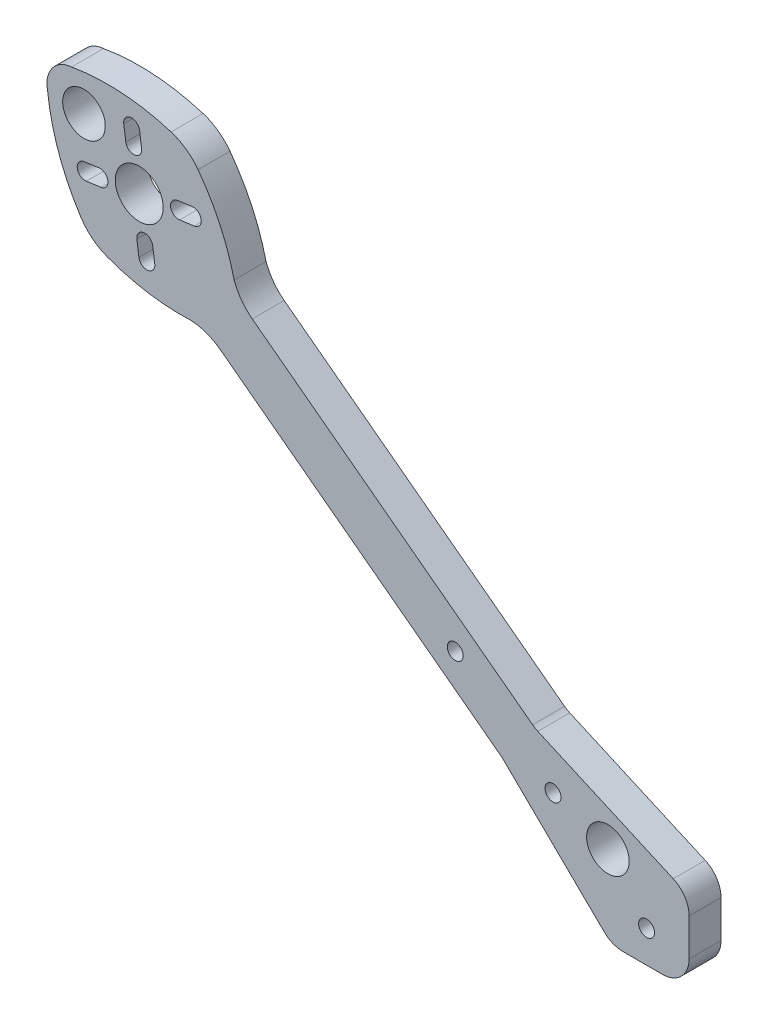
from build123d import *

# Parameters (mm, degrees)
CROQUIS1_R              = 1.5
CROQUIS1_R_2            = 4
CROQUIS1_R_3            = 4.5
SALIENTE_EXTRUIR1_DEPTH = 6


with BuildPart() as part:
    # Croquis1 → Saliente-Extruir1 (new body)
    with BuildSketch(Plane.XY):
        with BuildLine():
            ThreePointArc((-166.230647244, 74.874670253), (-162.695113338, 76.339136347), (-161.230647244, 79.874670253))
            Line((-161.230647244, 79.874670253), (-161.230647244, 86.870701075))
            ThreePointArc((-161.230647244, 86.870701075), (-162.039949935, 89.59798105), (-164.20586967, 91.442383017))
            Line((-164.20586967, 91.442383017), (-189.641602091, 102.707755643))
            ThreePointArc((-189.641602091, 102.707755643), (-190.150317176, 102.968821046), (-190.625899632, 103.286260034))
            Line((-190.625899632, 103.286260034), (-243.282498112, 142.965853083))
            ThreePointArc((-243.282498112, 142.965853083), (-245.323514753, 145.031918552), (-246.684791002, 147.597323475))
            ThreePointArc((-246.684791002, 147.597323475), (-249.33333249, 155.226277836), (-253.46024382, 162.167770437))
            ThreePointArc((-253.46024382, 162.167770437), (-255.706791789, 164.36963499), (-258.526200935, 165.764668091))
            ThreePointArc((-258.526200935, 165.764668091), (-267.807267276, 167.484933762), (-277.233031605, 166.98246665))
            ThreePointArc((-277.233031605, 166.98246665), (-280.839635864, 165.006508056), (-281.744934312, 160.994969527))
            ThreePointArc((-281.744934312, 160.994969527), (-279.629843944, 151.795844616), (-275.418009863, 143.348480526))
            ThreePointArc((-275.418009863, 143.348480526), (-273.299883496, 141.022813744), (-270.564082899, 139.470209357))
            ThreePointArc((-270.564082899, 139.470209357), (-262.753961023, 137.416502238), (-254.690502443, 136.973385563))
            ThreePointArc((-254.690502443, 136.973385563), (-251.84925837, 136.371964278), (-249.300648344, 134.979497983))
            Line((-249.300648344, 134.979497983), (-196.590704681, 95.259706455))
            ThreePointArc((-196.590704681, 95.259706455), (-196.340024178, 95.057833866), (-196.102851224, 94.840251132))
            Line((-196.102851224, 94.840251132), (-177.15641917, 76.300948025))
            ThreePointArc((-177.15641917, 76.300948025), (-175.547795242, 75.244950437), (-173.659490598, 74.874670253))
            Line((-173.659490598, 74.874670253), (-166.230647244, 74.874670253))
        make_face()
        with Locations((-169.217002345, 80.892820484)):
            Circle(CROQUIS1_R, mode=Mode.SUBTRACT)
        with Locations((-176.480647244, 90.124670253)):
            Circle(CROQUIS1_R_2, mode=Mode.SUBTRACT)
        with Locations((-186.790930649, 94.135725334)):
            Circle(CROQUIS1_R, mode=Mode.SUBTRACT)
        with Locations((-205.155600297, 107.974496526)):
            Circle(CROQUIS1_R, mode=Mode.SUBTRACT)
        with BuildLine():
            Line((-261.989778965, 145.534030037), (-261.600094282, 142.761279445))
            ThreePointArc((-261.600094282, 142.761279445), (-262.876736734, 141.06711769), (-264.570898489, 142.343760142))
            Line((-264.570898489, 142.343760142), (-264.960583171, 145.116510734))
            ThreePointArc((-264.960583171, 145.116510734), (-263.68394072, 146.810672489), (-261.989778965, 145.534030037))
        make_face(mode=Mode.SUBTRACT)
        with BuildLine():
            Line((-271.680758131, 150.180525793), (-274.453508724, 149.79084111))
            ThreePointArc((-274.453508724, 149.79084111), (-276.147670478, 151.067483562), (-274.871028026, 152.761645316))
            Line((-274.871028026, 152.761645316), (-272.098277434, 153.151329999))
            ThreePointArc((-272.098277434, 153.151329999), (-270.404115679, 151.874687547), (-271.680758131, 150.180525793))
        make_face(mode=Mode.SUBTRACT)
        with Locations((-264.51202067, 152.702767498)):
            Circle(CROQUIS1_R_3, mode=Mode.SUBTRACT)
        with BuildLine():
            Line((-257.34328321, 155.225009203), (-254.570532617, 155.614693886))
            ThreePointArc((-254.570532617, 155.614693886), (-252.876370863, 154.338051434), (-254.153013314, 152.64388968))
            Line((-254.153013314, 152.64388968), (-256.925763907, 152.254204997))
            ThreePointArc((-256.925763907, 152.254204997), (-258.619925661, 153.530847449), (-257.34328321, 155.225009203))
        make_face(mode=Mode.SUBTRACT)
        with Locations((-274.894282301, 160.526362799)):
            Circle(CROQUIS1_R_2, mode=Mode.SUBTRACT)
        with BuildLine():
            Line((-267.034262376, 159.871504959), (-267.423947058, 162.644255551))
            ThreePointArc((-267.423947058, 162.644255551), (-266.147304607, 164.338417306), (-264.453142852, 163.061774854))
            Line((-264.453142852, 163.061774854), (-264.063458169, 160.289024262))
            ThreePointArc((-264.063458169, 160.289024262), (-265.340100621, 158.594862507), (-267.034262376, 159.871504959))
        make_face(mode=Mode.SUBTRACT)
    extrude(amount=SALIENTE_EXTRUIR1_DEPTH)


solid = part.part
